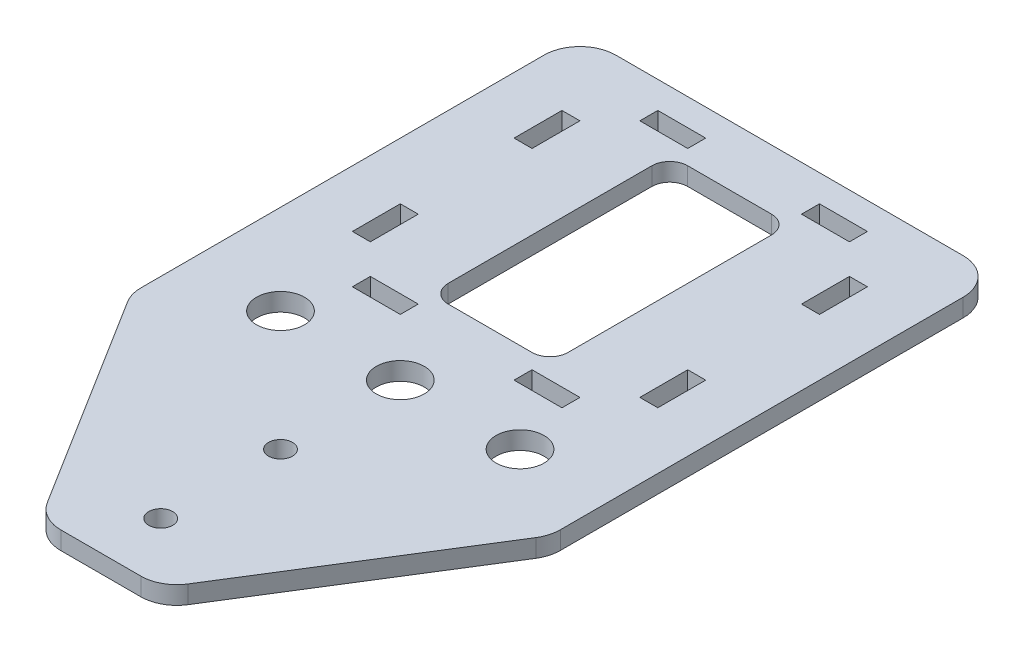
from build123d import *

# Parameters (mm, degrees)
SKETCH_1_R          = 2
SKETCH_1_W          = 3
SKETCH_1_H          = 8
SKETCH_1_W_2        = 8
SKETCH_1_H_2        = 3
EXTRUDE_1_DEPTH     = 3
SKETCH_2_R          = 4
CUT_EXTRUDE_1_DEPTH = 10
SKETCH_3_W          = 70
SKETCH_3_H          = 15
CUT_EXTRUDE_2_DEPTH = 10
SKETCH_4_W          = 20
SKETCH_4_H          = 40
CUT_EXTRUDE_3_DEPTH = 10
FILLET_1_R          = 3
FILLET_2_R          = 6


with BuildPart() as part:
    # 草图1 → 凸台-拉伸1 (new body)
    with BuildSketch(Plane(origin=(0, 0, 0), x_dir=(1, 0, 0), z_dir=(0, 1, 0))):
        Polygon((-35, -45), (-10, -85), (10, -85), (35, -45), (35, 45), (-35, 45), align=None)
        with Locations(Location((0, -55, 0), (0, 0, 270))):
            Circle(SKETCH_1_R, mode=Mode.SUBTRACT)
        with Locations(Location((0, -75, 0), (0, 0, 270))):
            Circle(SKETCH_1_R, mode=Mode.SUBTRACT)
        with Locations((-24, 13.5)):
            Rectangle(SKETCH_1_W, SKETCH_1_H, mode=Mode.SUBTRACT)
        with Locations((-24, -13.5)):
            Rectangle(SKETCH_1_W, SKETCH_1_H, mode=Mode.SUBTRACT)
        with Locations((13.5, 24)):
            Rectangle(SKETCH_1_W_2, SKETCH_1_H_2, mode=Mode.SUBTRACT)
        with Locations((-13.5, 24)):
            Rectangle(SKETCH_1_W_2, SKETCH_1_H_2, mode=Mode.SUBTRACT)
        with Locations((-13.5, -24)):
            Rectangle(SKETCH_1_W_2, SKETCH_1_H_2, mode=Mode.SUBTRACT)
        with Locations((13.5, -24)):
            Rectangle(SKETCH_1_W_2, SKETCH_1_H_2, mode=Mode.SUBTRACT)
        with Locations((24, 13.5)):
            Rectangle(SKETCH_1_W, SKETCH_1_H, mode=Mode.SUBTRACT)
        with Locations((24, -13.5)):
            Rectangle(SKETCH_1_W, SKETCH_1_H, mode=Mode.SUBTRACT)
    extrude(amount=EXTRUDE_1_DEPTH)

    # 草图2 → 切除-拉伸1 (cut)
    with BuildSketch(Plane(origin=(0, 3, 0), x_dir=(1, 0, 0), z_dir=(0, 1, 0))):
        with Locations(Location((0, -35, 0), (0, 0, 270))):
            Circle(SKETCH_2_R)
        with Locations(Location((-20, -35, 0), (0, 0, 270))):
            Circle(SKETCH_2_R)
        with Locations(Location((20, -35, 0), (0, 0, 270))):
            Circle(SKETCH_2_R)
    extrude(amount=-CUT_EXTRUDE_1_DEPTH, mode=Mode.SUBTRACT)

    # 草图3 → 切除-拉伸2 (cut)
    with BuildSketch(Plane(origin=(0, 3, 0), x_dir=(1, 0, 0), z_dir=(0, 1, 0))):
        with Locations((0, 37.5)):
            Rectangle(SKETCH_3_W, SKETCH_3_H)
    extrude(amount=-CUT_EXTRUDE_2_DEPTH, mode=Mode.SUBTRACT)

    # 草图4 → 切除-拉伸3 (cut)
    with BuildSketch(Plane(origin=(0, 3, 0), x_dir=(1, 0, 0), z_dir=(0, 1, 0))):
        Rectangle(SKETCH_4_W, SKETCH_4_H)
    extrude(amount=-CUT_EXTRUDE_3_DEPTH, mode=Mode.SUBTRACT)

    # 圆角1
    fillet_1_edges = [part.edges().sort_by_distance(p)[0] for p in [
        (10, 1.5, -20),
        (10, 1.5, 20),
        (-10, 1.5, 20),
        (-10, 1.5, -20),
    ]]
    fillet(fillet_1_edges, radius=FILLET_1_R)

    # 圆角2
    fillet_2_edges = [part.edges().sort_by_distance(p)[0] for p in [
        (-35, 1.5, -30),
        (35, 1.5, -30),
        (-10, 1.5, 85),
        (-35, 1.5, 45),
        (35, 1.5, 45),
        (10, 1.5, 85),
    ]]
    fillet(fillet_2_edges, radius=FILLET_2_R)


solid = part.part
